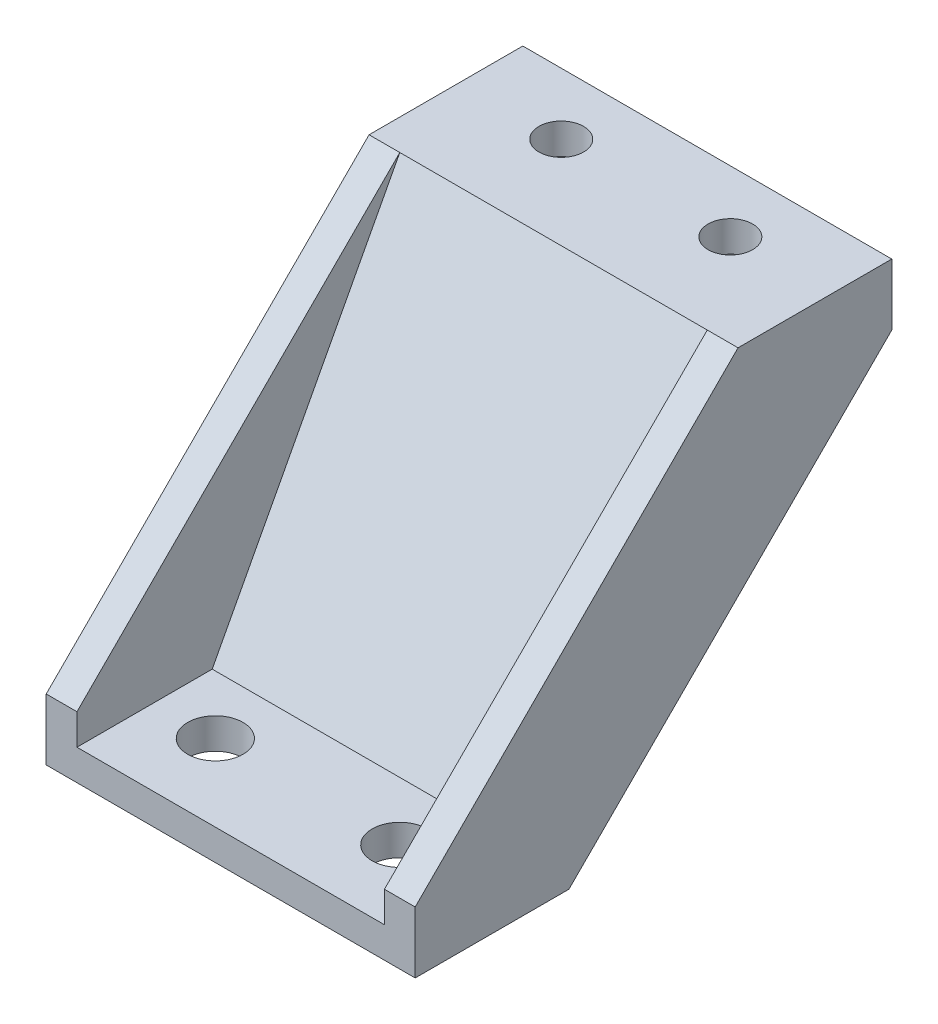
from build123d import *

# Parameters (mm, degrees)
BOSS_EXTRUDE1_DEPTH    = 2
BOSS_EXTRUDE2_DEPTH    = 10
M3_CLEARANCE_HOLE1_D   = 3.6
M2_5_CLEARANCE_HOLE1_D = 2.9


with BuildPart() as part:
    # Sketch1 → Boss-Extrude1 (new body)
    with BuildSketch(Plane(origin=(0, 0, 0), x_dir=(0, 0, -1), z_dir=(1, 0, 0))):
        Polygon((0, 0), (10, 0), (31, 21), (31, 25), (21, 25), (0, 4), align=None)
    extrude(amount=BOSS_EXTRUDE1_DEPTH)

    # Sketch2 → Boss-Extrude2 (add)
    with BuildSketch(Plane(origin=(2, 0, 0), x_dir=(0, 0, -1), z_dir=(1, 0, 0))):
        Polygon((10, 0), (0, 0), (0, 2), (8.797060967, 2), (21, 25), (31, 25), (31, 23), (22.202939033, 23), align=None)
    extrude(amount=BOSS_EXTRUDE2_DEPTH)

    # M3 Clearance Hole1 (through all)
    with Locations(Plane(origin=(0, 2, 0), x_dir=(1, 0, 0), z_dir=(0, 1, 0))):
        with Locations((6, 5)):
            Hole(M3_CLEARANCE_HOLE1_D / 2)

    # M2.5 Clearance Hole1 (through all)
    with Locations(Plane(origin=(0, 25, 0), x_dir=(1, 0, 0), z_dir=(0, 1, 0))):
        with Locations((6.5, 27)):
            Hole(M2_5_CLEARANCE_HOLE1_D / 2)

    # Mirror1: part across plane


with BuildPart() as part_1:
    add(part.part)
    add(part.part.mirror(Plane.ZY.offset(-12)))


solid = part_1.part
